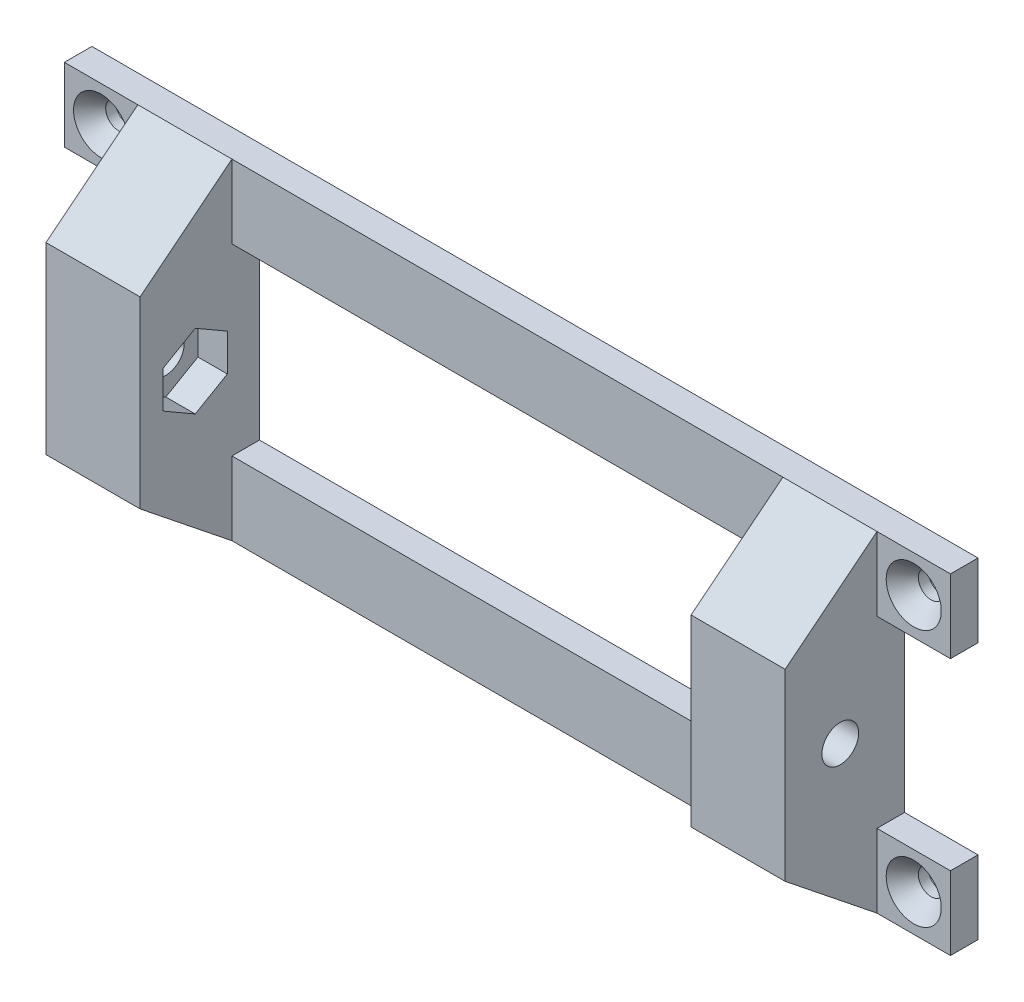
from build123d import *
from OCP.BRepFilletAPI import BRepFilletAPI_MakeChamfer

# Parameters (mm, degrees)
SKETCH_1_W               = 60
SKETCH_1_H               = 20
EXTRUDE_1_DEPTH          = 3
SKETCH_2_W               = 10.25
SKETCH_2_H               = 20
EXTRUDE_2_DEPTH          = 10
CUT_EXTRUDE_1_DEPTH      = 54.113675264
CUT_EXTRUDE_1_DEPTH_BACK = 54.113675264
SKETCH_3_R               = 2
SKETCH_4_R               = 1.4
CUT_EXTRUDE_2_DEPTH      = 54.113675264
EXTRUDE_3_DEPTH          = 10.25
EXTRUDE_4_DEPTH          = 10.25
CUT_EXTRUDE_3_DEPTH      = 3.2
CHAMFER_1_SIZE           = 1.6
CHAMFER_1_SIZE2          = 1.9


with BuildPart() as part:
    # 스케치1 → 보스-돌출1 (new body)
    with BuildSketch(Plane.XY):
        Polygon((-48.25, 18), (48.25, 18), (48.25, 10), (40.25, 10), (40.25, -10), (48.25, -10), (48.25, -18), (-48.25, -18), (-48.25, -10), (-40.25, -10), (-40.25, 10), (-48.25, 10), align=None)
        Rectangle(SKETCH_1_W, SKETCH_1_H, mode=Mode.SUBTRACT)
    extrude(amount=EXTRUDE_1_DEPTH)

    # 스케치2 → 보스-돌출2 (add)
    with BuildSketch(Plane.XY.offset(3)):
        with Locations((35.125, 0)):
            Rectangle(SKETCH_2_W, SKETCH_2_H)
        with Locations((-35.125, 0)):
            Rectangle(SKETCH_2_W, SKETCH_2_H)
    extrude(amount=EXTRUDE_2_DEPTH)

    # 스케치3 → 컷-돌출1 (cut, two sides: drawn at the far end of the back side and taken through both)
    with BuildSketch(Plane(origin=(0, 0, 0), x_dir=(0, 0, -1), z_dir=(1, 0, 0)).offset(-CUT_EXTRUDE_1_DEPTH_BACK)):
        with Locations((-7, 0)):
            Circle(SKETCH_3_R)
    extrude(amount=CUT_EXTRUDE_1_DEPTH + CUT_EXTRUDE_1_DEPTH_BACK, mode=Mode.SUBTRACT)

    # 스케치4 → 컷-돌출2 (cut, through all)
    with BuildSketch(Plane.XY):
        with Locations(Location((44.25, 14, 0), (0, 0, 180))):
            Circle(SKETCH_4_R)
        with Locations(Location((-44.25, 14, 0), (0, 0, 180))):
            Circle(SKETCH_4_R)
        with Locations(Location((44.25, -14, 0), (0, 0, 180))):
            Circle(SKETCH_4_R)
        with Locations(Location((-44.25, -14, 0), (0, 0, 180))):
            Circle(SKETCH_4_R)
    extrude(amount=CUT_EXTRUDE_2_DEPTH, mode=Mode.SUBTRACT)

    # 스케치5 → 보스-돌출3 (add)
    with BuildSketch(Plane(origin=(40.25, 0, 0), x_dir=(0, 0, -1), z_dir=(1, 0, 0))):
        Polygon((-13, 10), (-3, 18), (-3, 10), align=None)
        Polygon((-13, -10), (-3, -10), (-3, -18), align=None)
    extrude(amount=-EXTRUDE_3_DEPTH)

    # 스케치6 → 보스-돌출4 (add)
    with BuildSketch(Plane.ZY.offset(40.25)):
        Polygon((3, 18), (3, 10), (13, 10), align=None)
        Polygon((3, -10), (3, -18), (13, -10), align=None)
    extrude(amount=-EXTRUDE_4_DEPTH)

    # 스케치7 → 컷-돌출3 (cut)
    with BuildSketch(Plane.ZY.offset(-30)):
        Polygon((7, 4.041451884), (3.5, 2.020725942), (3.5, -2.020725942), (7, -4.041451884), (10.5, -2.020725942), (10.5, 2.020725942), align=None)
    cut_extrude_3 = extrude(amount=-CUT_EXTRUDE_3_DEPTH, mode=Mode.SUBTRACT)

    # 대칭 복사2: 컷-돌출3 across plane
    add(cut_extrude_3.mirror(Plane(origin=(0, 0, 0), x_dir=(0, 0, 1), z_dir=(1, 0, 0))), mode=Mode.SUBTRACT)

    # 모따기1: one chamfer whose edges measure the first distance from different faces: ONE call of the kernel's chamfer builder (chamfer() names one face for all edges)
    chamfer_1_edges_1 = [part.edges().sort_by_distance(p)[0] for p in [
        (45.65, -14, 3),
    ]]
    chamfer_1_side_1 = [part.faces().sort_by_distance(p)[0] for p in [
        (44.25, -17.886862915, 3),
    ]]
    chamfer_1_edges_2 = [part.edges().sort_by_distance(p)[0] for p in [
        (-42.85, -14, 3),
    ]]
    chamfer_1_side_2 = [part.faces().sort_by_distance(p)[0] for p in [
        (-44.25, -17.886862915, 3),
    ]]
    chamfer_1_edges_3 = [part.edges().sort_by_distance(p)[0] for p in [
        (45.65, 14, 3),
    ]]
    chamfer_1_side_3 = [part.faces().sort_by_distance(p)[0] for p in [
        (40.363137085, 14, 3),
    ]]
    chamfer_1_edges_4 = [part.edges().sort_by_distance(p)[0] for p in [
        (-42.85, 14, 3),
    ]]
    chamfer_1_side_4 = [part.faces().sort_by_distance(p)[0] for p in [
        (-40.363137085, 14, 3),
    ]]
    chamfer_1 = BRepFilletAPI_MakeChamfer(part.part.solid().wrapped)
    for e in chamfer_1_edges_1:
        chamfer_1.Add(CHAMFER_1_SIZE, CHAMFER_1_SIZE2, e.wrapped, chamfer_1_side_1[0].wrapped)  # the first distance lies on this face
    for e in chamfer_1_edges_2:
        chamfer_1.Add(CHAMFER_1_SIZE, CHAMFER_1_SIZE2, e.wrapped, chamfer_1_side_2[0].wrapped)  # the first distance lies on this face
    for e in chamfer_1_edges_3:
        chamfer_1.Add(CHAMFER_1_SIZE, CHAMFER_1_SIZE2, e.wrapped, chamfer_1_side_3[0].wrapped)  # the first distance lies on this face
    for e in chamfer_1_edges_4:
        chamfer_1.Add(CHAMFER_1_SIZE, CHAMFER_1_SIZE2, e.wrapped, chamfer_1_side_4[0].wrapped)  # the first distance lies on this face
    add(Compound.cast(chamfer_1.Shape()), mode=Mode.REPLACE)


solid = part.part
